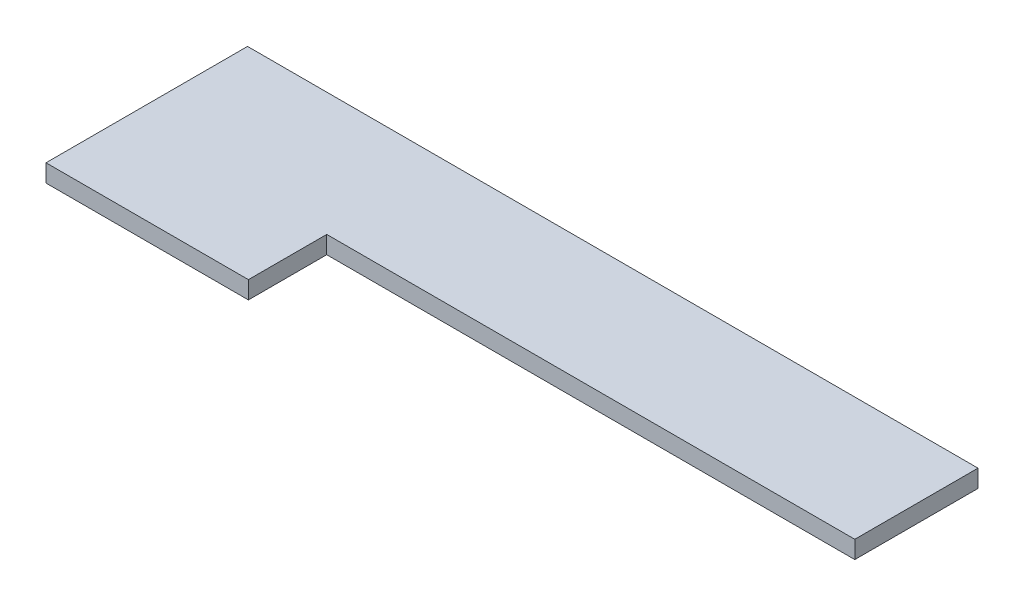
from build123d import *

# Parameters (mm, degrees)
EXTRUDE_1_DEPTH = 1


with BuildPart() as part:
    # Эскиз1 → Бобышка-Вытянуть1 (new body)
    with BuildSketch(Plane(origin=(0, 0, 0), x_dir=(1, 0, 0), z_dir=(0, 1, 0))):
        Polygon((6.5, 7.73), (36.5, 7.73), (36.5, 0.73), (6.5, 0.73), (6.5, -3.72), (-5, -3.72), (-5, 7.73), align=None)
    extrude(amount=EXTRUDE_1_DEPTH)


solid = part.part
